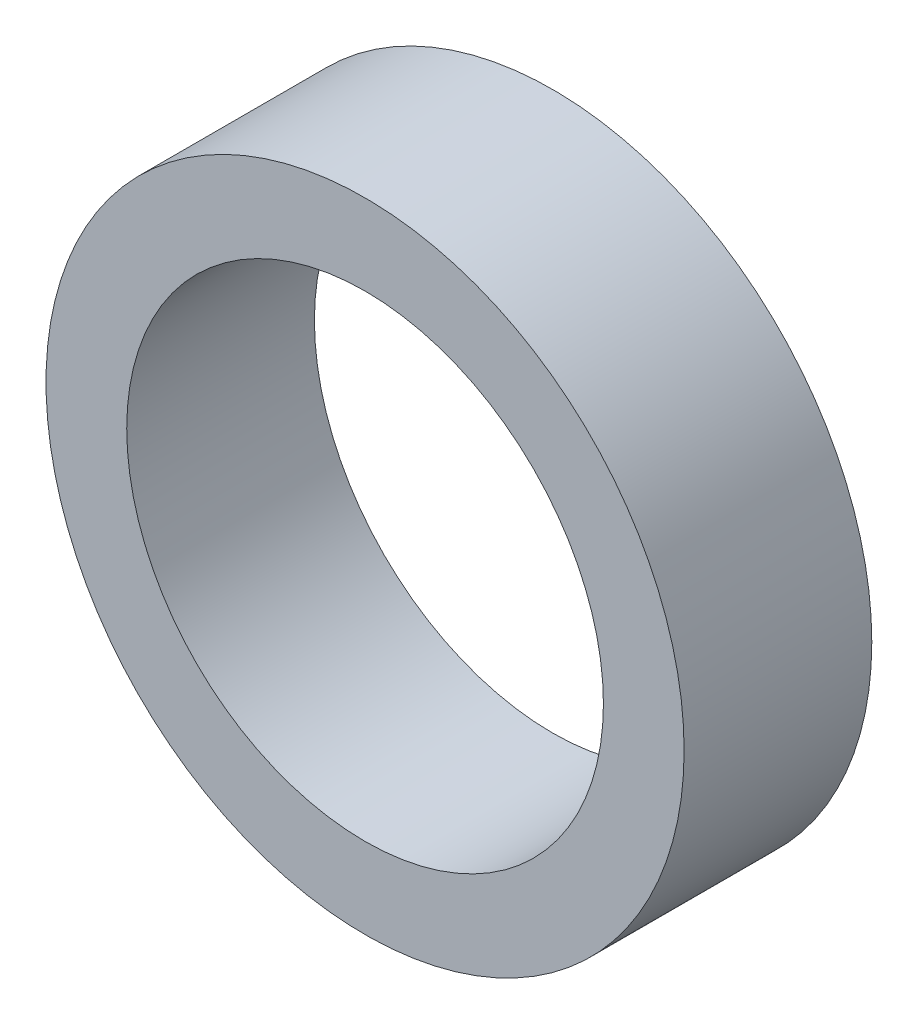
from build123d import *

# Parameters (mm, degrees)
ESBO_O1_W = 10
ESBO_O1_H = 4.3


with BuildPart() as part:
    # Esboço1 → Revolução1 (revolve)
    with BuildSketch(Plane(origin=(0, 0, 0), x_dir=(0, 0, -1), z_dir=(1, 0, 0)), mode=Mode.PRIVATE) as revolu_o1_sk:
        with Locations((5, 14.85)):
            Rectangle(ESBO_O1_W, ESBO_O1_H)
    revolve(revolu_o1_sk.sketch.rotate(Axis((0, 0, 0), (0, 0, -1)), 90), axis=Axis((0, 0, 0), (0, 0, -1)))


solid = part.part
